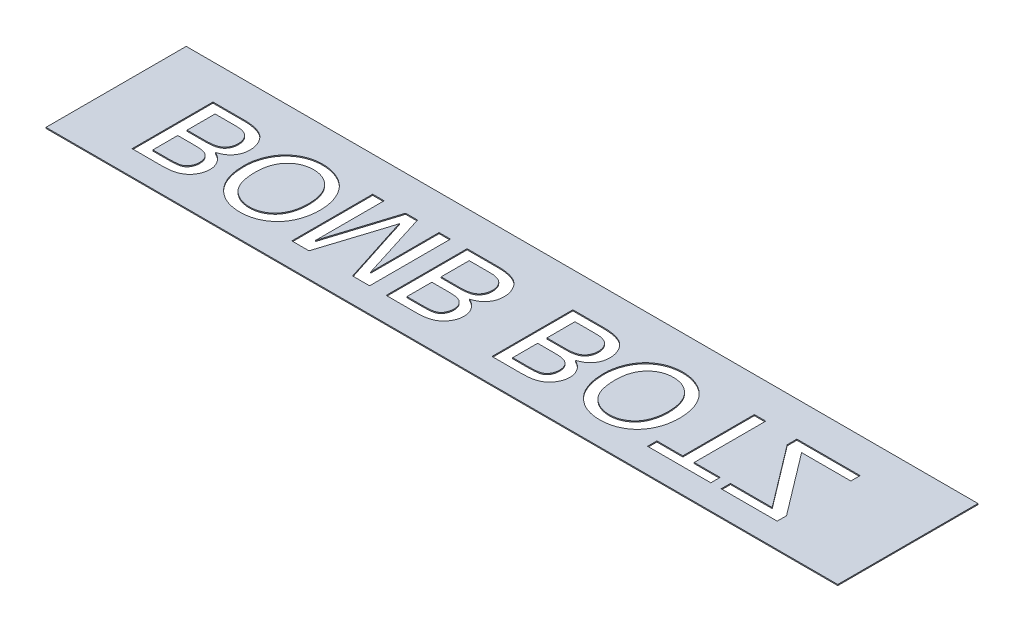
from build123d import *

# Parameters (mm, degrees)
SKETCH1_W               = 2438.4
SKETCH1_H               = 431.8
BOSS_EXTRUDE1_DEPTH     = 1.5875
CUT_EXTRUDE1_DEPTH      = 1239.172657841
CUT_EXTRUDE1_DEPTH_BACK = 1239.172657841


with BuildPart() as part:
    # Sketch1 → Boss-Extrude1 (new, symmetric)
    with BuildSketch(Plane(origin=(0, 0, 0), x_dir=(1, 0, 0), z_dir=(0, 1, 0))):
        Rectangle(SKETCH1_W, SKETCH1_H)
    extrude(amount=BOSS_EXTRUDE1_DEPTH, both=True)

    # Sketch6 → Cut-Extrude1 (cut, two sides: drawn at the far end of the back side and taken through both)
    # profile 1 of 8: a face of its own
    with BuildSketch(Plane.XZ.offset(1.5875).offset(-CUT_EXTRUDE1_DEPTH_BACK)):
        with BuildLine():
            Line((-1029.638251041, -108.819929139), (-1029.638251041, 140.306983296))
            Line((-1029.638251041, 140.306983296), (-936.365374571, 140.306983296))
            add(Edge.make_bspline(
                [(-936.365374571, 140.306983296), (-934.052361499, 140.29811002), (-929.539015447, 140.280795736), (-922.948596934, 139.84778342), (-916.706978477, 139.255512373), (-910.80072332, 138.49205683), (-905.255387765, 137.38429834), (-900.076139435, 136.04232298), (-895.236025636, 134.494397759), (-889.319724082, 132.136406264), (-882.501835173, 128.506956134), (-875.199228456, 123.091243827), (-868.845676887, 116.588916018), (-863.617638302, 109.133628989), (-859.310298361, 101.1699764), (-856.256444767, 92.849673395), (-854.303950761, 84.353873246), (-854.08241752, 78.601121013), (-853.971838427, 75.729614568)],
                knots=[0, 0, 0, 0, 0.939712594, 1.833646414, 2.682508961, 3.487467313, 4.25240329, 4.978730417, 5.660668875, 6.315918528, 7.564895217, 8.787077865, 9.996481721, 11.241996224, 12.475862915, 13.665015424, 14.834484263, 16, 16, 16, 16], degree=3))
            add(Edge.make_bspline(
                [(-853.971838427, 75.729614568), (-854.088080401, 73.058067285), (-854.319443669, 67.740728953), (-856.160836422, 59.907966177), (-859.067117543, 52.302402292), (-863.176681327, 45.016498055), (-868.429218961, 38.183547426), (-874.940865696, 32.034738593), (-882.618049761, 26.556893957), (-888.379776146, 23.63704173), (-891.350856338, 22.131396628)],
                knots=[0, 0, 0, 0, 0.926741525, 1.844548388, 2.778836836, 3.746021974, 4.738420572, 5.759761325, 6.844803049, 8, 8, 8, 8], degree=3))
            add(Edge.make_bspline(
                [(-891.350856338, 22.131396628), (-889.512926443, 21.556045752), (-885.914572415, 20.429606628), (-880.741564685, 18.368381023), (-875.885690292, 16.02138068), (-871.33637934, 13.384748813), (-867.124370947, 10.434068913), (-863.261549833, 7.16474103), (-859.721132865, 3.627357163), (-856.509445345, -0.175930941), (-853.688314809, -4.220648312), (-851.158113148, -8.418393401), (-849.06878268, -12.81971631), (-847.35623458, -17.413190104), (-846.020192463, -22.170431122), (-845.060768792, -27.109736564), (-844.513921795, -32.219609229), (-844.431787123, -35.690849809), (-844.390034102, -37.455449014)],
                knots=[0, 0, 0, 0, 1.127427615, 2.20731145, 3.257257018, 4.283066884, 5.282973838, 6.264540225, 7.242620376, 8.210460609, 9.17525685, 10.12748095, 11.077310519, 12.023587065, 12.994999128, 13.967387486, 14.966724908, 16, 16, 16, 16], degree=3))
            add(Edge.make_bspline(
                [(-844.390034102, -37.455449014), (-844.476093443, -40.28848835), (-844.646673528, -45.903917031), (-846.016621778, -54.168883711), (-848.331761684, -62.119085078), (-851.518354871, -69.625975983), (-855.315308924, -76.567201835), (-859.630680236, -82.761018709), (-864.354417909, -88.143692657), (-869.619537541, -92.671483556), (-875.39207685, -96.514253022), (-881.835076773, -99.75011622), (-888.898721197, -102.603837459), (-896.726574758, -104.883495329), (-905.315074234, -106.694452569), (-914.780773435, -107.871034437), (-925.138214982, -108.713309326), (-932.35437082, -108.783395942), (-936.115848416, -108.819929139)],
                knots=[0, 0, 0, 0, 1.028073207, 2.037766189, 3.031549473, 4.027532207, 4.992436545, 5.898794514, 6.762903869, 7.584966804, 8.412380356, 9.273953678, 10.198004568, 11.174406109, 12.229717296, 13.381036288, 14.634844708, 16, 16, 16, 16], degree=3))
            Line((-936.115848416, -108.819929139), (-1029.638251041, -108.819929139))
        make_face()
        with BuildLine():
            Line((-994.504968518, 34.907135727), (-943.152485967, 34.907135727))
            add(Edge.make_bspline(
                [(-943.152485967, 34.907135727), (-941.472104876, 34.91378395), (-938.243713232, 34.926556687), (-933.5868352, 35.104646757), (-929.288759997, 35.256583086), (-925.36611315, 35.637931531), (-921.799461551, 36.011445392), (-918.603078507, 36.514253274), (-915.761307957, 37.080803713), (-914.021291368, 37.606321835), (-913.209347453, 37.851544348)],
                knots=[0, 0, 0, 0, 1.335841395, 2.566453063, 3.705076039, 4.753984432, 5.69893722, 6.555639608, 7.326018133, 8, 8, 8, 8], degree=3))
            add(Edge.make_bspline(
                [(-913.209347453, 37.851544348), (-911.301570437, 38.519838786), (-907.623775582, 39.808170612), (-902.695186458, 42.73410171), (-898.497461093, 46.245204748), (-895.041848471, 50.403477165), (-892.386381399, 55.186665621), (-890.417429216, 60.495578404), (-889.339384209, 66.404429199), (-889.185331386, 70.502009612), (-889.10512095, 72.635490255)],
                knots=[0, 0, 0, 0, 1.059015028, 2.041559358, 2.989777133, 3.920090524, 4.862499371, 5.848878527, 6.879979022, 8, 8, 8, 8], degree=3))
            add(Edge.make_bspline(
                [(-889.10512095, 72.635490255), (-889.169615571, 74.685903192), (-889.295308152, 78.681921549), (-890.350384982, 84.484833032), (-892.17615646, 89.883376589), (-894.648751013, 94.876367972), (-897.779712694, 99.318350933), (-901.516624677, 103.137416516), (-905.993181464, 106.024461951), (-910.177421166, 107.825406843), (-913.940813162, 108.952067792), (-917.303271738, 109.618666699), (-921.117302658, 110.206006629), (-925.395456855, 110.705343509), (-930.139352635, 111.092874933), (-935.363606765, 111.400742969), (-941.055783256, 111.531456262), (-944.998949044, 111.551282372), (-947.045093974, 111.561570323)],
                knots=[0, 0, 0, 0, 1.216168307, 2.37017178, 3.484610845, 4.588286376, 5.664695412, 6.69777344, 7.738183022, 8.803673002, 9.390844981, 10.0665252, 10.835811589, 11.680682236, 12.621801058, 13.660007223, 14.785756265, 16, 16, 16, 16], degree=3))
            Line((-947.045093974, 111.561570323), (-994.504968518, 111.561570323))
            Line((-994.504968518, 111.561570323), (-994.504968518, 34.907135727))
        make_face(mode=Mode.SUBTRACT)
        with BuildLine():
            Line((-994.504968518, -80.074516166), (-935.566890877, -80.074516166))
            add(Edge.make_bspline(
                [(-935.566890877, -80.074516166), (-933.221291351, -80.047568547), (-928.911777879, -79.998058338), (-923.017205402, -79.842742401), (-918.252568427, -79.463363667), (-915.470272222, -79.054869623), (-914.257357301, -78.876790625)],
                knots=[0, 0, 0, 0, 1.317581857, 2.420761387, 3.311546315, 4, 4, 4, 4], degree=3))
            add(Edge.make_bspline(
                [(-914.257357301, -78.876790625), (-912.518397384, -78.511278871), (-909.151321392, -77.803553616), (-904.404552125, -76.22398468), (-900.052364806, -74.414504277), (-896.170720288, -72.11485571), (-892.576410594, -69.464668267), (-889.452687961, -66.154457324), (-886.57559114, -62.393497211), (-884.082840045, -58.089506178), (-882.067088828, -53.328145369), (-880.52648466, -48.182981164), (-879.705846666, -42.672053594), (-879.585018607, -38.888502532), (-879.523316625, -36.956396706)],
                knots=[0, 0, 0, 0, 1.067651492, 2.067249321, 3.003744366, 3.895862395, 4.774133402, 5.679610569, 6.621910665, 7.616993802, 8.661192143, 9.724711987, 10.838102842, 12, 12, 12, 12], degree=3))
            add(Edge.make_bspline(
                [(-879.523316625, -36.956396706), (-879.592059342, -34.687988683), (-879.726114657, -30.264361477), (-881.000356397, -23.871996034), (-883.10519522, -17.942997607), (-886.068194966, -12.559476867), (-889.702468823, -7.717463465), (-894.099573215, -3.610115301), (-899.226629331, -0.350731405), (-905.099394711, 2.207254145), (-911.963481059, 4.027216807), (-920.008392164, 5.261951235), (-929.362808898, 6.058695765), (-936.04745904, 6.125909518), (-939.609214576, 6.161722754)],
                knots=[0, 0, 0, 0, 0.96167883, 1.875371887, 2.752872588, 3.621584364, 4.472914353, 5.312011319, 6.159851575, 7.038572308, 8.019870099, 9.164119506, 10.488969081, 12, 12, 12, 12], degree=3))
            Line((-939.609214576, 6.161722754), (-994.504968518, 6.161722754))
            Line((-994.504968518, 6.161722754), (-994.504968518, -80.074516166))
        make_face(mode=Mode.SUBTRACT)
    # profile 2 of 8: a face of its own
    with BuildSketch(Plane.XZ.offset(1.5875).offset(-CUT_EXTRUDE1_DEPTH_BACK)):
        with BuildLine():
            add(Edge.make_bspline(
                [(-812.450686354, 12.449781842), (-812.364099426, 17.44456171), (-812.195389188, 27.176636979), (-810.61903851, 41.34779258), (-808.059449622, 54.680996309), (-804.40029082, 67.175209415), (-799.762296522, 78.850010414), (-794.12392846, 89.731835108), (-787.315588249, 99.697509075), (-779.613620526, 108.841899057), (-771.01087634, 116.92621005), (-761.851398909, 124.106236461), (-752.020815093, 130.095227347), (-741.609951942, 135.040159408), (-730.57457819, 138.836735053), (-718.945677814, 141.494683466), (-706.735687846, 143.209318487), (-698.389873943, 143.402306371), (-694.125383994, 143.500918071)],
                knots=[0, 0, 0, 0, 1.203621547, 2.345195544, 3.432004029, 4.472479546, 5.478447225, 6.455936844, 7.420185704, 8.381829745, 9.332027588, 10.260832629, 11.182364398, 12.100723901, 13.034044877, 13.989196293, 14.972532542, 16, 16, 16, 16], degree=3))
            add(Edge.make_bspline(
                [(-694.125383994, 143.500918071), (-691.312659836, 143.451802612), (-685.72709839, 143.354268194), (-677.469344306, 142.612161527), (-669.42378546, 141.28762969), (-661.59834471, 139.512608496), (-653.971721159, 137.183857882), (-646.539360331, 134.434838643), (-639.366324239, 131.028416721), (-632.404892587, 127.214588406), (-625.73723992, 122.948656527), (-619.470996639, 118.236090238), (-613.621172376, 113.112530467), (-608.109188125, 107.662194574), (-603.118971042, 101.701141328), (-598.44436257, 95.410954624), (-594.219690328, 88.68009926), (-590.429964251, 81.563723198), (-587.041564028, 74.171737566), (-584.145521719, 66.473505595), (-581.658743031, 58.561372963), (-579.57709947, 50.388508297), (-578.08346405, 41.957705644), (-576.894066017, 33.3052925), (-576.268052971, 24.402989868), (-576.156166924, 18.3893258), (-576.099513019, 15.344285232)],
                knots=[0, 0, 0, 0, 1.034375294, 2.054082248, 3.045783978, 4.031219655, 5.002789406, 5.976610191, 6.94273282, 7.920236376, 8.894345378, 9.851183672, 10.800797181, 11.752517031, 12.698794154, 13.65688337, 14.632873302, 15.61821402, 16.620222298, 17.621258913, 18.640965868, 19.669244166, 20.720417492, 21.788124603, 22.880008887, 24, 24, 24, 24], degree=3))
            add(Edge.make_bspline(
                [(-576.099513019, 15.344285232), (-576.151420332, 12.249031877), (-576.253972179, 6.133825168), (-576.947879941, -2.900206149), (-578.168010978, -11.674889162), (-579.78630706, -20.216388391), (-581.954774404, -28.506922209), (-584.531664611, -36.570260087), (-587.648558901, -44.358375173), (-591.168744949, -51.890038436), (-595.15183397, -59.061663371), (-599.545451429, -65.823102591), (-604.352709924, -72.111108176), (-609.500587755, -78.002817903), (-615.109301504, -83.392876984), (-621.109787529, -88.331686425), (-627.478973995, -92.865824813), (-634.238258129, -96.8724935), (-641.266335359, -100.384481721), (-648.424131115, -103.500247999), (-655.716962369, -106.157497471), (-663.169753784, -108.310934054), (-670.762174877, -109.938225735), (-678.472859672, -111.15675891), (-686.327084863, -111.858394497), (-691.6121474, -111.961774474), (-694.275099686, -112.013863914)],
                knots=[0, 0, 0, 0, 1.141429366, 2.255090526, 3.338676798, 4.407031443, 5.458968682, 6.496860253, 7.526652771, 8.550250826, 9.560787671, 10.54935636, 11.521089193, 12.477323897, 13.431786008, 14.386110112, 15.340986122, 16.312041, 17.28047646, 18.236612773, 19.189437236, 20.140779471, 21.09494583, 22.051062463, 23.018000708, 24, 24, 24, 24], degree=3))
            add(Edge.make_bspline(
                [(-694.275099686, -112.013863914), (-697.138364844, -111.971501551), (-702.809776047, -111.887592319), (-711.192274551, -111.050035158), (-719.366229666, -109.772312532), (-727.30787825, -107.927667077), (-735.006368357, -105.52119675), (-742.470809061, -102.60848121), (-749.727453589, -99.228447996), (-756.68625899, -95.284315691), (-763.323540333, -90.898864529), (-769.574966691, -86.093894395), (-775.437081254, -80.913687354), (-780.815821081, -75.272620764), (-785.885386621, -69.375185478), (-790.443073867, -63.002177482), (-794.637729774, -56.298129925), (-798.345227598, -49.198418694), (-801.694397047, -41.914020286), (-804.516144651, -34.442604621), (-806.995913922, -26.894280504), (-808.97079913, -19.222523222), (-810.544542317, -11.445029772), (-811.602770569, -3.57474163), (-812.367031059, 4.400062657), (-812.422660929, 9.753039138), (-812.450686354, 12.449781842)],
                knots=[0, 0, 0, 0, 1.072727997, 2.12480551, 3.153819198, 4.171534612, 5.177148798, 6.173931848, 7.17235114, 8.174500385, 9.168706755, 10.151274001, 11.127173509, 12.097141049, 13.070188938, 14.039134204, 15.03036519, 16.031505612, 17.038625933, 18.033164522, 19.022845559, 20.014762458, 21.000193215, 21.994692725, 22.989758729, 24, 24, 24, 24], degree=3))
        make_face()
        with BuildLine():
            add(Edge.make_bspline(
                [(-777.317403831, 12.050539995), (-777.263563741, 8.453847828), (-777.158579364, 1.440551936), (-775.95750127, -8.784460524), (-774.135057091, -18.432280494), (-771.623010164, -27.529991725), (-768.246203924, -35.987619195), (-764.208794844, -43.886432487), (-759.374842413, -51.173924797), (-753.850998025, -57.829710132), (-747.775402451, -63.808768947), (-741.283011998, -69.031158765), (-734.37236721, -73.404540831), (-727.120084877, -77.015701337), (-719.474075242, -79.834541394), (-711.457238184, -81.813859861), (-703.063683382, -83.051762889), (-697.340314106, -83.195321714), (-694.424815379, -83.26845094)],
                knots=[0, 0, 0, 0, 1.215430442, 2.370003584, 3.475209778, 4.53279855, 5.55522989, 6.548792651, 7.526809858, 8.505409025, 9.467826767, 10.404123909, 11.316848639, 12.227335424, 13.138360512, 14.065900994, 15.014765094, 16, 16, 16, 16], degree=3))
            add(Edge.make_bspline(
                [(-694.424815379, -83.26845094), (-691.459898816, -83.194240084), (-685.654600543, -83.048935436), (-677.13450151, -81.832642273), (-669.039453665, -79.761955008), (-661.289220618, -77.00540119), (-654.023919085, -73.279010344), (-647.073634418, -68.915427053), (-640.627832272, -63.583253257), (-634.528286444, -57.593619854), (-629.057404719, -50.785301418), (-624.203148911, -43.326008524), (-620.259893174, -35.103870741), (-616.855424061, -26.300010508), (-614.362475565, -16.748031517), (-612.520033862, -6.556520571), (-611.409739485, 4.307305215), (-611.292819763, 11.76512004), (-611.232795541, 15.593811386)],
                knots=[0, 0, 0, 0, 0.976878588, 1.912725521, 2.8289017, 3.727303729, 4.617335839, 5.514666588, 6.426584173, 7.368641557, 8.327632997, 9.299405846, 10.294892156, 11.327373912, 12.405931897, 13.542618837, 14.738430195, 16, 16, 16, 16], degree=3))
            add(Edge.make_bspline(
                [(-611.232795541, 15.593811386), (-611.254008078, 18.056942192), (-611.295619399, 22.888713465), (-611.846692745, 30.010799608), (-612.55750665, 36.911348093), (-613.639731871, 43.581454742), (-615.131175536, 49.993497127), (-616.783441843, 56.196290258), (-618.849543081, 62.136381875), (-621.193822875, 67.837066748), (-623.81703227, 73.269078641), (-626.775663587, 78.386623533), (-630.035331461, 83.169805541), (-633.508086252, 87.709308952), (-637.386229482, 91.829436391), (-641.483026254, 95.704223954), (-645.891535166, 99.253617677), (-650.567760916, 102.478544722), (-655.445365177, 105.38148731), (-660.514292804, 107.866029511), (-665.693788564, 110.048387683), (-671.070549889, 111.721256814), (-676.570334067, 113.070450322), (-682.215374157, 114.095288449), (-688.026623047, 114.625997326), (-691.945262226, 114.712025836), (-693.92576307, 114.755505098)],
                knots=[0, 0, 0, 0, 1.220438779, 2.394059227, 3.538503547, 4.658058814, 5.74010225, 6.800155734, 7.837851593, 8.854470756, 9.853724944, 10.825214244, 11.781044712, 12.72106398, 13.654479919, 14.581868691, 15.514082315, 16.456304431, 17.39516604, 18.324312202, 19.252140633, 20.177768678, 21.111585046, 22.057694709, 23.018348693, 24, 24, 24, 24], degree=3))
            add(Edge.make_bspline(
                [(-693.92576307, 114.755505098), (-696.724930848, 114.69991473), (-702.248000777, 114.590228741), (-710.378617207, 113.370898664), (-718.217413004, 111.549052927), (-725.776553139, 109.00201551), (-732.99138545, 105.629337685), (-739.899289367, 101.4932099), (-746.561582659, 96.706252382), (-752.873210462, 91.151831995), (-758.757028118, 84.771158865), (-763.731205666, 77.248540768), (-767.923578402, 68.763558394), (-771.424132408, 59.337719205), (-774.093201749, 48.898026304), (-775.937862514, 37.489406592), (-777.102543686, 25.099838194), (-777.243952814, 16.51150795), (-777.317403831, 12.050539995)],
                knots=[0, 0, 0, 0, 0.895090134, 1.766112571, 2.624765742, 3.468151641, 4.313618154, 5.168136083, 6.041303099, 6.935189387, 7.854749729, 8.809996334, 9.809869957, 10.877771942, 12.021723904, 13.25217762, 14.572720513, 16, 16, 16, 16], degree=3))
        make_face(mode=Mode.SUBTRACT)
    # profile 3 of 8: a face of its own
    with BuildSketch(Plane.XZ.offset(1.5875).offset(-CUT_EXTRUDE1_DEPTH_BACK)):
        with BuildLine():
            Line((-537.772295721, -108.819929139), (-537.772295721, 140.306983296))
            Line((-537.772295721, 140.306983296), (-484.922656244, 140.306983296))
            Line((-484.922656244, 140.306983296), (-429.228418608, -34.511040394))
            add(Edge.make_bspline(
                [(-429.228418608, -34.511040394), (-428.615501156, -36.49142394), (-427.430154481, -40.321370436), (-425.672425994, -45.852165593), (-424.073187746, -50.991799959), (-422.632821878, -55.756633263), (-421.273529999, -60.123008325), (-420.096597411, -64.126754472), (-418.971411567, -67.723381184), (-418.312002384, -70.009155061), (-417.999741666, -71.091574611)],
                knots=[0, 0, 0, 0, 1.300204174, 2.514519184, 3.639827924, 4.676153899, 5.636536826, 6.507959918, 7.293450077, 8, 8, 8, 8], degree=3))
            add(Edge.make_bspline(
                [(-417.999741666, -71.091574611), (-417.651955736, -69.910019021), (-416.911845036, -67.395593166), (-415.712007282, -63.442089529), (-414.43534575, -59.067092884), (-412.907573221, -54.34580229), (-411.315051172, -49.204155516), (-409.643492021, -43.646422534), (-407.715381091, -37.728090642), (-406.434055018, -33.630738508), (-405.772960106, -31.516726542)],
                knots=[0, 0, 0, 0, 0.713638162, 1.518667645, 2.393860736, 3.354087503, 4.393659122, 5.512594909, 6.716633584, 8, 8, 8, 8], degree=3))
            Line((-405.772960106, -31.516726542), (-350.62768001, 140.306983296))
            Line((-350.62768001, 140.306983296), (-298.22718761, 140.306983296))
            Line((-298.22718761, 140.306983296), (-298.22718761, -108.819929139))
            Line((-298.22718761, -108.819929139), (-333.360470133, -108.819929139))
            Line((-333.360470133, -108.819929139), (-333.360470133, 101.979765998))
            Line((-333.360470133, 101.979765998), (-399.834237634, -108.819929139))
            Line((-399.834237634, -108.819929139), (-436.564487544, -108.819929139))
            Line((-436.564487544, -108.819929139), (-502.639013198, 101.979765998))
            Line((-502.639013198, 101.979765998), (-502.639013198, -108.819929139))
            Line((-502.639013198, -108.819929139), (-537.772295721, -108.819929139))
        make_face()
    # profile 4 of 8: a face of its own
    with BuildSketch(Plane.XZ.offset(1.5875).offset(-CUT_EXTRUDE1_DEPTH_BACK)):
        with BuildLine():
            Line((-247.124231214, -108.819929139), (-247.124231214, 140.306983296))
            Line((-247.124231214, 140.306983296), (-153.851354743, 140.306983296))
            add(Edge.make_bspline(
                [(-153.851354743, 140.306983296), (-151.538341671, 140.29811002), (-147.02499562, 140.280795736), (-140.434577107, 139.84778342), (-134.19295865, 139.255512373), (-128.286703492, 138.49205683), (-122.741367937, 137.38429834), (-117.562119607, 136.04232298), (-112.722005808, 134.494397759), (-106.805704254, 132.136406264), (-99.987815345, 128.506956134), (-92.685208628, 123.091243827), (-86.331657059, 116.588916018), (-81.103618475, 109.133628989), (-76.796278533, 101.1699764), (-73.74242494, 92.849673395), (-71.789930933, 84.353873246), (-71.568397693, 78.601121013), (-71.457818599, 75.729614568)],
                knots=[0, 0, 0, 0, 0.939712594, 1.833646414, 2.682508961, 3.487467313, 4.25240329, 4.978730417, 5.660668875, 6.315918528, 7.564895217, 8.787077865, 9.996481721, 11.241996224, 12.475862915, 13.665015424, 14.834484263, 16, 16, 16, 16], degree=3))
            add(Edge.make_bspline(
                [(-71.457818599, 75.729614568), (-71.574060574, 73.058067285), (-71.805423841, 67.740728953), (-73.646816595, 59.907966177), (-76.553097716, 52.302402292), (-80.662661499, 45.016498055), (-85.915199133, 38.183547426), (-92.426845869, 32.034738593), (-100.104029933, 26.556893957), (-105.865756319, 23.63704173), (-108.836836511, 22.131396628)],
                knots=[0, 0, 0, 0, 0.926741525, 1.844548388, 2.778836836, 3.746021974, 4.738420572, 5.759761325, 6.844803049, 8, 8, 8, 8], degree=3))
            add(Edge.make_bspline(
                [(-108.836836511, 22.131396628), (-106.998906616, 21.556045752), (-103.400552587, 20.429606628), (-98.227544857, 18.368381023), (-93.371670465, 16.02138068), (-88.822359513, 13.384748813), (-84.61035112, 10.434068913), (-80.747530005, 7.16474103), (-77.207113037, 3.627357163), (-73.995425517, -0.175930941), (-71.174294981, -4.220648312), (-68.64409332, -8.418393401), (-66.554762852, -12.81971631), (-64.842214752, -17.413190104), (-63.506172636, -22.170431122), (-62.546748965, -27.109736564), (-61.999901968, -32.219609229), (-61.917767295, -35.690849809), (-61.876014275, -37.455449014)],
                knots=[0, 0, 0, 0, 1.127427615, 2.20731145, 3.257257018, 4.283066884, 5.282973838, 6.264540225, 7.242620376, 8.210460609, 9.17525685, 10.12748095, 11.077310519, 12.023587065, 12.994999128, 13.967387486, 14.966724908, 16, 16, 16, 16], degree=3))
            add(Edge.make_bspline(
                [(-61.876014275, -37.455449014), (-61.962073616, -40.28848835), (-62.132653701, -45.903917031), (-63.502601951, -54.168883711), (-65.817741856, -62.119085078), (-69.004335043, -69.625975983), (-72.801289097, -76.567201835), (-77.116660409, -82.761018709), (-81.840398082, -88.143692657), (-87.105517713, -92.671483556), (-92.878057023, -96.514253022), (-99.321056945, -99.75011622), (-106.38470137, -102.603837459), (-114.21255493, -104.883495329), (-122.801054406, -106.694452569), (-132.266753607, -107.871034437), (-142.624195154, -108.713309326), (-149.840350992, -108.783395942), (-153.601828589, -108.819929139)],
                knots=[0, 0, 0, 0, 1.028073207, 2.037766189, 3.031549473, 4.027532207, 4.992436545, 5.898794514, 6.762903869, 7.584966804, 8.412380356, 9.273953678, 10.198004568, 11.174406109, 12.229717296, 13.381036288, 14.634844708, 16, 16, 16, 16], degree=3))
            Line((-153.601828589, -108.819929139), (-247.124231214, -108.819929139))
        make_face()
        with BuildLine():
            Line((-211.990948691, 34.907135727), (-160.63846614, 34.907135727))
            add(Edge.make_bspline(
                [(-160.63846614, 34.907135727), (-158.958085048, 34.91378395), (-155.729693404, 34.926556687), (-151.072815373, 35.104646757), (-146.774740169, 35.256583086), (-142.852093322, 35.637931531), (-139.285441724, 36.011445392), (-136.089058679, 36.514253274), (-133.247288129, 37.080803713), (-131.50727154, 37.606321835), (-130.695327626, 37.851544348)],
                knots=[0, 0, 0, 0, 1.335841395, 2.566453063, 3.705076039, 4.753984432, 5.69893722, 6.555639608, 7.326018133, 8, 8, 8, 8], degree=3))
            add(Edge.make_bspline(
                [(-130.695327626, 37.851544348), (-128.78755061, 38.519838786), (-125.109755755, 39.808170612), (-120.181166631, 42.73410171), (-115.983441266, 46.245204748), (-112.527828643, 50.403477165), (-109.872361571, 55.186665621), (-107.903409389, 60.495578404), (-106.825364381, 66.404429199), (-106.671311559, 70.502009612), (-106.591101122, 72.635490255)],
                knots=[0, 0, 0, 0, 1.059015028, 2.041559358, 2.989777133, 3.920090524, 4.862499371, 5.848878527, 6.879979022, 8, 8, 8, 8], degree=3))
            add(Edge.make_bspline(
                [(-106.591101122, 72.635490255), (-106.655595744, 74.685903192), (-106.781288324, 78.681921549), (-107.836365154, 84.484833032), (-109.662136632, 89.883376589), (-112.134731185, 94.876367972), (-115.265692867, 99.318350933), (-119.00260485, 103.137416516), (-123.479161637, 106.024461951), (-127.663401338, 107.825406843), (-131.426793334, 108.952067792), (-134.78925191, 109.618666699), (-138.60328283, 110.206006629), (-142.881437028, 110.705343509), (-147.625332807, 111.092874933), (-152.849586938, 111.400742969), (-158.541763429, 111.531456262), (-162.484929217, 111.551282372), (-164.531074146, 111.561570323)],
                knots=[0, 0, 0, 0, 1.216168307, 2.37017178, 3.484610845, 4.588286376, 5.664695412, 6.69777344, 7.738183022, 8.803673002, 9.390844981, 10.0665252, 10.835811589, 11.680682236, 12.621801058, 13.660007223, 14.785756265, 16, 16, 16, 16], degree=3))
            Line((-164.531074146, 111.561570323), (-211.990948691, 111.561570323))
            Line((-211.990948691, 111.561570323), (-211.990948691, 34.907135727))
        make_face(mode=Mode.SUBTRACT)
        with BuildLine():
            Line((-211.990948691, -80.074516166), (-153.052871049, -80.074516166))
            add(Edge.make_bspline(
                [(-153.052871049, -80.074516166), (-150.707271524, -80.047568547), (-146.397758051, -79.998058338), (-140.503185575, -79.842742401), (-135.7385486, -79.463363667), (-132.956252394, -79.054869623), (-131.743337474, -78.876790625)],
                knots=[0, 0, 0, 0, 1.317581857, 2.420761387, 3.311546315, 4, 4, 4, 4], degree=3))
            add(Edge.make_bspline(
                [(-131.743337474, -78.876790625), (-130.004377557, -78.511278871), (-126.637301565, -77.803553616), (-121.890532298, -76.22398468), (-117.538344979, -74.414504277), (-113.656700461, -72.11485571), (-110.062390767, -69.464668267), (-106.938668134, -66.154457324), (-104.061571312, -62.393497211), (-101.568820217, -58.089506178), (-99.553069, -53.328145369), (-98.012464832, -48.182981164), (-97.191826838, -42.672053594), (-97.070998779, -38.888502532), (-97.009296798, -36.956396706)],
                knots=[0, 0, 0, 0, 1.067651492, 2.067249321, 3.003744366, 3.895862395, 4.774133402, 5.679610569, 6.621910665, 7.616993802, 8.661192143, 9.724711987, 10.838102842, 12, 12, 12, 12], degree=3))
            add(Edge.make_bspline(
                [(-97.009296798, -36.956396706), (-97.078039514, -34.687988683), (-97.212094829, -30.264361477), (-98.486336569, -23.871996034), (-100.591175392, -17.942997607), (-103.554175139, -12.559476867), (-107.188448996, -7.717463465), (-111.585553388, -3.610115301), (-116.712609504, -0.350731405), (-122.585374884, 2.207254145), (-129.449461231, 4.027216807), (-137.494372336, 5.261951235), (-146.84878907, 6.058695765), (-153.533439212, 6.125909518), (-157.095194749, 6.161722754)],
                knots=[0, 0, 0, 0, 0.96167883, 1.875371887, 2.752872588, 3.621584364, 4.472914353, 5.312011319, 6.159851575, 7.038572308, 8.019870099, 9.164119506, 10.488969081, 12, 12, 12, 12], degree=3))
            Line((-157.095194749, 6.161722754), (-211.990948691, 6.161722754))
            Line((-211.990948691, 6.161722754), (-211.990948691, -80.074516166))
        make_face(mode=Mode.SUBTRACT)
    # profile 5 of 8: a face of its own
    with BuildSketch(Plane.XZ.offset(1.5875).offset(-CUT_EXTRUDE1_DEPTH_BACK)):
        with BuildLine():
            Line((78.657115817, -108.819929139), (78.657115817, 140.306983296))
            Line((78.657115817, 140.306983296), (171.929992287, 140.306983296))
            add(Edge.make_bspline(
                [(171.929992287, 140.306983296), (174.243005359, 140.29811002), (178.75635141, 140.280795736), (185.346769923, 139.84778342), (191.588388381, 139.255512373), (197.494643538, 138.49205683), (203.039979093, 137.38429834), (208.219227423, 136.04232298), (213.059341222, 134.494397759), (218.975642776, 132.136406264), (225.793531685, 128.506956134), (233.096138402, 123.091243827), (239.449689971, 116.588916018), (244.677728555, 109.133628989), (248.985068497, 101.1699764), (252.038922091, 92.849673395), (253.991416097, 84.353873246), (254.212949337, 78.601121013), (254.323528431, 75.729614568)],
                knots=[0, 0, 0, 0, 0.939712594, 1.833646414, 2.682508961, 3.487467313, 4.25240329, 4.978730417, 5.660668875, 6.315918528, 7.564895217, 8.787077865, 9.996481721, 11.241996224, 12.475862915, 13.665015424, 14.834484263, 16, 16, 16, 16], degree=3))
            add(Edge.make_bspline(
                [(254.323528431, 75.729614568), (254.207286456, 73.058067285), (253.975923189, 67.740728953), (252.134530436, 59.907966177), (249.228249315, 52.302402292), (245.118685531, 45.016498055), (239.866147897, 38.183547426), (233.354501162, 32.034738593), (225.677317097, 26.556893957), (219.915590711, 23.63704173), (216.94451052, 22.131396628)],
                knots=[0, 0, 0, 0, 0.926741525, 1.844548388, 2.778836836, 3.746021974, 4.738420572, 5.759761325, 6.844803049, 8, 8, 8, 8], degree=3))
            add(Edge.make_bspline(
                [(216.94451052, 22.131396628), (218.782440414, 21.556045752), (222.380794443, 20.429606628), (227.553802173, 18.368381023), (232.409676565, 16.02138068), (236.958987517, 13.384748813), (241.170995911, 10.434068913), (245.033817025, 7.16474103), (248.574233993, 3.627357163), (251.785921513, -0.175930941), (254.607052049, -4.220648312), (257.13725371, -8.418393401), (259.226584178, -12.81971631), (260.939132278, -17.413190104), (262.275174395, -22.170431122), (263.234598065, -27.109736564), (263.781445063, -32.219609229), (263.863579735, -35.690849809), (263.905332755, -37.455449014)],
                knots=[0, 0, 0, 0, 1.127427615, 2.20731145, 3.257257018, 4.283066884, 5.282973838, 6.264540225, 7.242620376, 8.210460609, 9.17525685, 10.12748095, 11.077310519, 12.023587065, 12.994999128, 13.967387486, 14.966724908, 16, 16, 16, 16], degree=3))
            add(Edge.make_bspline(
                [(263.905332755, -37.455449014), (263.819273415, -40.28848835), (263.648693329, -45.903917031), (262.27874508, -54.168883711), (259.963605174, -62.119085078), (256.777011987, -69.625975983), (252.980057934, -76.567201835), (248.664686622, -82.761018709), (243.940948948, -88.143692657), (238.675829317, -92.671483556), (232.903290008, -96.514253022), (226.460290085, -99.75011622), (219.39664566, -102.603837459), (211.5687921, -104.883495329), (202.980292624, -106.694452569), (193.514593423, -107.871034437), (183.157151876, -108.713309326), (175.940996038, -108.783395942), (172.179518441, -108.819929139)],
                knots=[0, 0, 0, 0, 1.028073207, 2.037766189, 3.031549473, 4.027532207, 4.992436545, 5.898794514, 6.762903869, 7.584966804, 8.412380356, 9.273953678, 10.198004568, 11.174406109, 12.229717296, 13.381036288, 14.634844708, 16, 16, 16, 16], degree=3))
            Line((172.179518441, -108.819929139), (78.657115817, -108.819929139))
        make_face()
        with BuildLine():
            Line((113.79039834, 34.907135727), (165.142880891, 34.907135727))
            add(Edge.make_bspline(
                [(165.142880891, 34.907135727), (166.823261982, 34.91378395), (170.051653626, 34.926556687), (174.708531658, 35.104646757), (179.006606861, 35.256583086), (182.929253708, 35.637931531), (186.495905307, 36.011445392), (189.692288351, 36.514253274), (192.534058901, 37.080803713), (194.27407549, 37.606321835), (195.086019405, 37.851544348)],
                knots=[0, 0, 0, 0, 1.335841395, 2.566453063, 3.705076039, 4.753984432, 5.69893722, 6.555639608, 7.326018133, 8, 8, 8, 8], degree=3))
            add(Edge.make_bspline(
                [(195.086019405, 37.851544348), (196.99379642, 38.519838786), (200.671591276, 39.808170612), (205.6001804, 42.73410171), (209.797905765, 46.245204748), (213.253518387, 50.403477165), (215.908985459, 55.186665621), (217.877937641, 60.495578404), (218.955982649, 66.404429199), (219.110035471, 70.502009612), (219.190245908, 72.635490255)],
                knots=[0, 0, 0, 0, 1.059015028, 2.041559358, 2.989777133, 3.920090524, 4.862499371, 5.848878527, 6.879979022, 8, 8, 8, 8], degree=3))
            add(Edge.make_bspline(
                [(219.190245908, 72.635490255), (219.125751286, 74.685903192), (219.000058706, 78.681921549), (217.944981876, 84.484833032), (216.119210398, 89.883376589), (213.646615845, 94.876367972), (210.515654164, 99.318350933), (206.77874218, 103.137416516), (202.302185394, 106.024461951), (198.117945692, 107.825406843), (194.354553696, 108.952067792), (190.99209512, 109.618666699), (187.1780642, 110.206006629), (182.899910002, 110.705343509), (178.156014223, 111.092874933), (172.931760092, 111.400742969), (167.239583602, 111.531456262), (163.296417814, 111.551282372), (161.250272884, 111.561570323)],
                knots=[0, 0, 0, 0, 1.216168307, 2.37017178, 3.484610845, 4.588286376, 5.664695412, 6.69777344, 7.738183022, 8.803673002, 9.390844981, 10.0665252, 10.835811589, 11.680682236, 12.621801058, 13.660007223, 14.785756265, 16, 16, 16, 16], degree=3))
            Line((161.250272884, 111.561570323), (113.79039834, 111.561570323))
            Line((113.79039834, 111.561570323), (113.79039834, 34.907135727))
        make_face(mode=Mode.SUBTRACT)
        with BuildLine():
            Line((113.79039834, -80.074516166), (172.728475981, -80.074516166))
            add(Edge.make_bspline(
                [(172.728475981, -80.074516166), (175.074075506, -80.047568547), (179.383588979, -79.998058338), (185.278161455, -79.842742401), (190.04279843, -79.463363667), (192.825094636, -79.054869623), (194.038009557, -78.876790625)],
                knots=[0, 0, 0, 0, 1.317581857, 2.420761387, 3.311546315, 4, 4, 4, 4], degree=3))
            add(Edge.make_bspline(
                [(194.038009557, -78.876790625), (195.776969473, -78.511278871), (199.144045466, -77.803553616), (203.890814732, -76.22398468), (208.243002052, -74.414504277), (212.12464657, -72.11485571), (215.718956263, -69.464668267), (218.842678897, -66.154457324), (221.719775718, -62.393497211), (224.212526813, -58.089506178), (226.22827803, -53.328145369), (227.768882198, -48.182981164), (228.589520192, -42.672053594), (228.710348251, -38.888502532), (228.772050233, -36.956396706)],
                knots=[0, 0, 0, 0, 1.067651492, 2.067249321, 3.003744366, 3.895862395, 4.774133402, 5.679610569, 6.621910665, 7.616993802, 8.661192143, 9.724711987, 10.838102842, 12, 12, 12, 12], degree=3))
            add(Edge.make_bspline(
                [(228.772050233, -36.956396706), (228.703307516, -34.687988683), (228.569252201, -30.264361477), (227.295010461, -23.871996034), (225.190171638, -17.942997607), (222.227171891, -12.559476867), (218.592898034, -7.717463465), (214.195793642, -3.610115301), (209.068737527, -0.350731405), (203.195972147, 2.207254145), (196.331885799, 4.027216807), (188.286974694, 5.261951235), (178.93255796, 6.058695765), (172.247907818, 6.125909518), (168.686152282, 6.161722754)],
                knots=[0, 0, 0, 0, 0.96167883, 1.875371887, 2.752872588, 3.621584364, 4.472914353, 5.312011319, 6.159851575, 7.038572308, 8.019870099, 9.164119506, 10.488969081, 12, 12, 12, 12], degree=3))
            Line((168.686152282, 6.161722754), (113.79039834, 6.161722754))
            Line((113.79039834, 6.161722754), (113.79039834, -80.074516166))
        make_face(mode=Mode.SUBTRACT)
    # profile 6 of 8: a face of its own
    with BuildSketch(Plane.XZ.offset(1.5875).offset(-CUT_EXTRUDE1_DEPTH_BACK)):
        with BuildLine():
            add(Edge.make_bspline(
                [(295.844680504, 12.449781842), (295.931267432, 17.44456171), (296.09997767, 27.176636979), (297.676328348, 41.34779258), (300.235917236, 54.680996309), (303.895076038, 67.175209415), (308.533070335, 78.850010414), (314.171438398, 89.731835108), (320.979778609, 99.697509075), (328.681746332, 108.841899057), (337.284490518, 116.92621005), (346.443967949, 124.106236461), (356.274551765, 130.095227347), (366.685414916, 135.040159408), (377.720788667, 138.836735053), (389.349689043, 141.494683466), (401.559679012, 143.209318487), (409.905492915, 143.402306371), (414.169982864, 143.500918071)],
                knots=[0, 0, 0, 0, 1.203621547, 2.345195544, 3.432004029, 4.472479546, 5.478447225, 6.455936844, 7.420185704, 8.381829745, 9.332027588, 10.260832629, 11.182364398, 12.100723901, 13.034044877, 13.989196293, 14.972532542, 16, 16, 16, 16], degree=3))
            add(Edge.make_bspline(
                [(414.169982864, 143.500918071), (416.982707021, 143.451802612), (422.568268468, 143.354268194), (430.826022552, 142.612161527), (438.871581398, 141.28762969), (446.697022148, 139.512608496), (454.323645699, 137.183857882), (461.756006527, 134.434838643), (468.929042619, 131.028416721), (475.89047427, 127.214588406), (482.558126938, 122.948656527), (488.824370219, 118.236090238), (494.674194482, 113.112530467), (500.186178732, 107.662194574), (505.176395816, 101.701141328), (509.851004288, 95.410954624), (514.07567653, 88.68009926), (517.865402607, 81.563723198), (521.25380283, 74.171737566), (524.149845139, 66.473505595), (526.636623827, 58.561372963), (528.718267388, 50.388508297), (530.211902808, 41.957705644), (531.401300841, 33.3052925), (532.027313887, 24.402989868), (532.139199934, 18.3893258), (532.195853839, 15.344285232)],
                knots=[0, 0, 0, 0, 1.034375294, 2.054082248, 3.045783978, 4.031219655, 5.002789406, 5.976610191, 6.94273282, 7.920236376, 8.894345378, 9.851183672, 10.800797181, 11.752517031, 12.698794154, 13.65688337, 14.632873302, 15.61821402, 16.620222298, 17.621258913, 18.640965868, 19.669244166, 20.720417492, 21.788124603, 22.880008887, 24, 24, 24, 24], degree=3))
            add(Edge.make_bspline(
                [(532.195853839, 15.344285232), (532.143946526, 12.249031877), (532.041394679, 6.133825168), (531.347486917, -2.900206149), (530.12735588, -11.674889162), (528.509059798, -20.216388391), (526.340592454, -28.506922209), (523.763702247, -36.570260087), (520.646807957, -44.358375173), (517.126621909, -51.890038436), (513.143532888, -59.061663371), (508.749915428, -65.823102591), (503.942656934, -72.111108176), (498.794779103, -78.002817903), (493.186065354, -83.392876984), (487.185579329, -88.331686425), (480.816392863, -92.865824813), (474.057108729, -96.8724935), (467.029031499, -100.384481721), (459.871235742, -103.500247999), (452.578404489, -106.157497471), (445.125613074, -108.310934054), (437.533191981, -109.938225735), (429.822507186, -111.15675891), (421.968281995, -111.858394497), (416.683219457, -111.961774474), (414.020267171, -112.013863914)],
                knots=[0, 0, 0, 0, 1.141429366, 2.255090526, 3.338676798, 4.407031443, 5.458968682, 6.496860253, 7.526652771, 8.550250826, 9.560787671, 10.54935636, 11.521089193, 12.477323897, 13.431786008, 14.386110112, 15.340986122, 16.312041, 17.28047646, 18.236612773, 19.189437236, 20.140779471, 21.09494583, 22.051062463, 23.018000708, 24, 24, 24, 24], degree=3))
            add(Edge.make_bspline(
                [(414.020267171, -112.013863914), (411.157002014, -111.971501551), (405.48559081, -111.887592319), (397.103092307, -111.050035158), (388.929137192, -109.772312532), (380.987488607, -107.927667077), (373.288998501, -105.52119675), (365.824557797, -102.60848121), (358.567913269, -99.228447996), (351.609107868, -95.284315691), (344.971826524, -90.898864529), (338.720400166, -86.093894395), (332.858285603, -80.913687354), (327.479545776, -75.272620764), (322.409980237, -69.375185478), (317.85229299, -63.002177482), (313.657637084, -56.298129925), (309.95013926, -49.198418694), (306.600969811, -41.914020286), (303.779222207, -34.442604621), (301.299452936, -26.894280504), (299.324567728, -19.222523222), (297.750824541, -11.445029772), (296.692596289, -3.57474163), (295.928335799, 4.400062657), (295.872705929, 9.753039138), (295.844680504, 12.449781842)],
                knots=[0, 0, 0, 0, 1.072727997, 2.12480551, 3.153819198, 4.171534612, 5.177148798, 6.173931848, 7.17235114, 8.174500385, 9.168706755, 10.151274001, 11.127173509, 12.097141049, 13.070188938, 14.039134204, 15.03036519, 16.031505612, 17.038625933, 18.033164522, 19.022845559, 20.014762458, 21.000193215, 21.994692725, 22.989758729, 24, 24, 24, 24], degree=3))
        make_face()
        with BuildLine():
            add(Edge.make_bspline(
                [(330.977963026, 12.050539995), (331.031803117, 8.453847828), (331.136787494, 1.440551936), (332.337865588, -8.784460524), (334.160309767, -18.432280494), (336.672356694, -27.529991725), (340.049162934, -35.987619195), (344.086572013, -43.886432487), (348.920524444, -51.173924797), (354.444368832, -57.829710132), (360.519964407, -63.808768947), (367.01235486, -69.031158765), (373.922999647, -73.404540831), (381.175281981, -77.015701337), (388.821291616, -79.834541394), (396.838128674, -81.813859861), (405.231683475, -83.051762889), (410.955052752, -83.195321714), (413.870551479, -83.26845094)],
                knots=[0, 0, 0, 0, 1.215430442, 2.370003584, 3.475209778, 4.53279855, 5.55522989, 6.548792651, 7.526809858, 8.505409025, 9.467826767, 10.404123909, 11.316848639, 12.227335424, 13.138360512, 14.065900994, 15.014765094, 16, 16, 16, 16], degree=3))
            add(Edge.make_bspline(
                [(413.870551479, -83.26845094), (416.835468042, -83.194240084), (422.640766314, -83.048935436), (431.160865348, -81.832642273), (439.255913193, -79.761955008), (447.006146239, -77.00540119), (454.271447772, -73.279010344), (461.22173244, -68.915427053), (467.667534586, -63.583253257), (473.767080414, -57.593619854), (479.237962138, -50.785301418), (484.092217947, -43.326008524), (488.035473684, -35.103870741), (491.439942797, -26.300010508), (493.932891292, -16.748031517), (495.775332996, -6.556520571), (496.885627373, 4.307305215), (497.002547095, 11.76512004), (497.062571316, 15.593811386)],
                knots=[0, 0, 0, 0, 0.976878588, 1.912725521, 2.8289017, 3.727303729, 4.617335839, 5.514666588, 6.426584173, 7.368641557, 8.327632997, 9.299405846, 10.294892156, 11.327373912, 12.405931897, 13.542618837, 14.738430195, 16, 16, 16, 16], degree=3))
            add(Edge.make_bspline(
                [(497.062571316, 15.593811386), (497.04135878, 18.056942192), (496.999747459, 22.888713465), (496.448674112, 30.010799608), (495.737860208, 36.911348093), (494.655634987, 43.581454742), (493.164191322, 49.993497127), (491.511925014, 56.196290258), (489.445823777, 62.136381875), (487.101543983, 67.837066748), (484.478334588, 73.269078641), (481.51970327, 78.386623533), (478.260035396, 83.169805541), (474.787280606, 87.709308952), (470.909137376, 91.829436391), (466.812340604, 95.704223954), (462.403831692, 99.253617677), (457.727605942, 102.478544722), (452.85000168, 105.38148731), (447.781074054, 107.866029511), (442.601578294, 110.048387683), (437.224816969, 111.721256814), (431.72503279, 113.070450322), (426.079992701, 114.095288449), (420.268743811, 114.625997326), (416.350104632, 114.712025836), (414.369603787, 114.755505098)],
                knots=[0, 0, 0, 0, 1.220438779, 2.394059227, 3.538503547, 4.658058814, 5.74010225, 6.800155734, 7.837851593, 8.854470756, 9.853724944, 10.825214244, 11.781044712, 12.72106398, 13.654479919, 14.581868691, 15.514082315, 16.456304431, 17.39516604, 18.324312202, 19.252140633, 20.177768678, 21.111585046, 22.057694709, 23.018348693, 24, 24, 24, 24], degree=3))
            add(Edge.make_bspline(
                [(414.369603787, 114.755505098), (411.57043601, 114.69991473), (406.047366081, 114.590228741), (397.91674965, 113.370898664), (390.077953854, 111.549052927), (382.518813719, 109.00201551), (375.303981408, 105.629337685), (368.396077491, 101.4932099), (361.733784199, 96.706252382), (355.422156396, 91.151831995), (349.53833874, 84.771158865), (344.564161192, 77.248540768), (340.371788456, 68.763558394), (336.87123445, 59.337719205), (334.202165109, 48.898026304), (332.357504343, 37.489406592), (331.192823172, 25.099838194), (331.051414043, 16.51150795), (330.977963026, 12.050539995)],
                knots=[0, 0, 0, 0, 0.895090134, 1.766112571, 2.624765742, 3.468151641, 4.313618154, 5.168136083, 6.041303099, 6.935189387, 7.854749729, 8.809996334, 9.809869957, 10.877771942, 12.021723904, 13.25217762, 14.572720513, 16, 16, 16, 16], degree=3))
        make_face(mode=Mode.SUBTRACT)
    # profile 7 of 8: a face of its own
    with BuildSketch(Plane.XZ.offset(1.5875).offset(-CUT_EXTRUDE1_DEPTH_BACK)):
        Polygon((637.595701408, -108.819929139), (637.595701408, 111.561570323), (557.747332038, 111.561570323), (557.747332038, 140.306983296), (752.577353301, 140.306983296), (752.577353301, 111.561570323), (672.728983931, 111.561570323), (672.728983931, -108.819929139), align=None)
    # profile 8 of 8: a face of its own
    with BuildSketch(Plane.XZ.offset(1.5875).offset(-CUT_EXTRUDE1_DEPTH_BACK)):
        with BuildLine():
            Line((768.547027175, -108.819929139), (768.547027175, -78.876790625))
            Line((768.547027175, -78.876790625), (891.21408462, 82.965873042))
            add(Edge.make_bspline(
                [(891.21408462, 82.965873042), (893.298673509, 85.690075875), (897.295941002, 90.913824061), (902.941722648, 98.461839083), (908.16089923, 105.218262622), (911.396817471, 109.528761156), (912.922860042, 111.561570323)],
                knots=[0, 0, 0, 0, 1.146521337, 2.198492228, 3.150418105, 4, 4, 4, 4], degree=3))
            Line((912.922860042, 111.561570323), (784.516701049, 111.561570323))
            Line((784.516701049, 111.561570323), (784.516701049, 140.306983296))
            Line((784.516701049, 140.306983296), (956.989178888, 140.306983296))
            Line((956.989178888, 140.306983296), (956.989178888, 111.561570323))
            Line((956.989178888, 111.561570323), (823.891928195, -64.054937061))
            Line((823.891928195, -64.054937061), (811.764957096, -80.074516166))
            Line((811.764957096, -80.074516166), (963.377048438, -80.074516166))
            Line((963.377048438, -80.074516166), (963.377048438, -108.819929139))
            Line((963.377048438, -108.819929139), (768.547027175, -108.819929139))
        make_face()
    extrude(amount=CUT_EXTRUDE1_DEPTH + CUT_EXTRUDE1_DEPTH_BACK, mode=Mode.SUBTRACT)


with BuildPart() as cut_extrude1_piece_1:
    # of the separate pieces the step leaves, piece 1, a body of its own (cut_extrude1_pieces)
    add(part.part.solids().sort_by_distance((1219.2, -1.5875, 215.9))[0])


with BuildPart() as cut_extrude1_piece_2:
    # of the separate pieces the step leaves, piece 2, a body of its own (cut_extrude1_pieces)
    add(part.part.solids().sort_by_distance((497.062571316, -1.5875, 15.593811386))[0])


with BuildPart() as cut_extrude1_piece_3:
    # of the separate pieces the step leaves, piece 3, a body of its own (cut_extrude1_pieces)
    add(part.part.solids().sort_by_distance((-611.232795541, -1.5875, 15.593811386))[0])


with BuildPart() as cut_extrude1_piece_4:
    # of the separate pieces the step leaves, piece 4, a body of its own (cut_extrude1_pieces)
    add(part.part.solids().sort_by_distance((-131.743337474, -1.5875, -78.876790625))[0])


with BuildPart() as cut_extrude1_piece_5:
    # of the separate pieces the step leaves, piece 5, a body of its own (cut_extrude1_pieces)
    add(part.part.solids().sort_by_distance((194.038009557, -1.5875, -78.876790625))[0])


with BuildPart() as cut_extrude1_piece_6:
    # of the separate pieces the step leaves, piece 6, a body of its own (cut_extrude1_pieces)
    add(part.part.solids().sort_by_distance((-914.257357301, -1.5875, -78.876790625))[0])


with BuildPart() as cut_extrude1_piece_7:
    # of the separate pieces the step leaves, piece 7, a body of its own (cut_extrude1_pieces)
    add(part.part.solids().sort_by_distance((-130.695327626, -1.5875, 37.851544348))[0])


with BuildPart() as cut_extrude1_piece_8:
    # of the separate pieces the step leaves, piece 8, a body of its own (cut_extrude1_pieces)
    add(part.part.solids().sort_by_distance((-913.209347453, -1.5875, 37.851544348))[0])


with BuildPart() as cut_extrude1_piece_9:
    # of the separate pieces the step leaves, piece 9, a body of its own (cut_extrude1_pieces)
    add(part.part.solids().sort_by_distance((195.086019405, -1.5875, 37.851544348))[0])


solid = Compound([cut_extrude1_piece_1.part, cut_extrude1_piece_2.part, cut_extrude1_piece_3.part, cut_extrude1_piece_4.part, cut_extrude1_piece_5.part, cut_extrude1_piece_6.part, cut_extrude1_piece_7.part, cut_extrude1_piece_8.part, cut_extrude1_piece_9.part])
